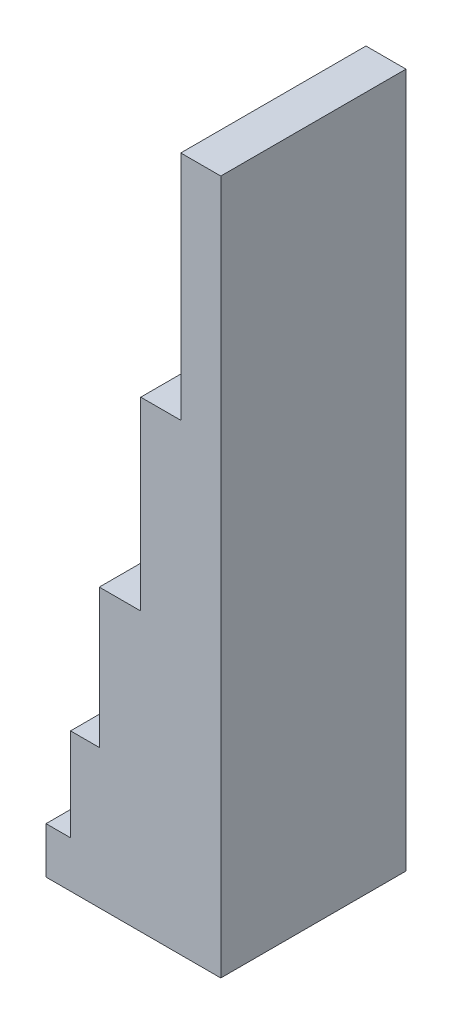
from build123d import *

# Parameters (mm, degrees)
BOSS_EXTRUDE3_DEPTH = 10


with BuildPart() as part:
    # Sketch1 → Boss-Extrude3 (new body)
    with BuildSketch(Plane.XY):
        Polygon((0, 0), (0, 2.5), (1.323532089, 2.5), (1.323532089, 7.5), (2.877071227, 7.5), (2.877071227, 15), (5.114167586, 15), (5.114167586, 25), (7.27495243, 25), (7.27495243, 37.5), (9.435737274, 37.5), (9.435737274, 25), (9.435737274, 0), align=None)
    extrude(amount=BOSS_EXTRUDE3_DEPTH)


solid = part.part
